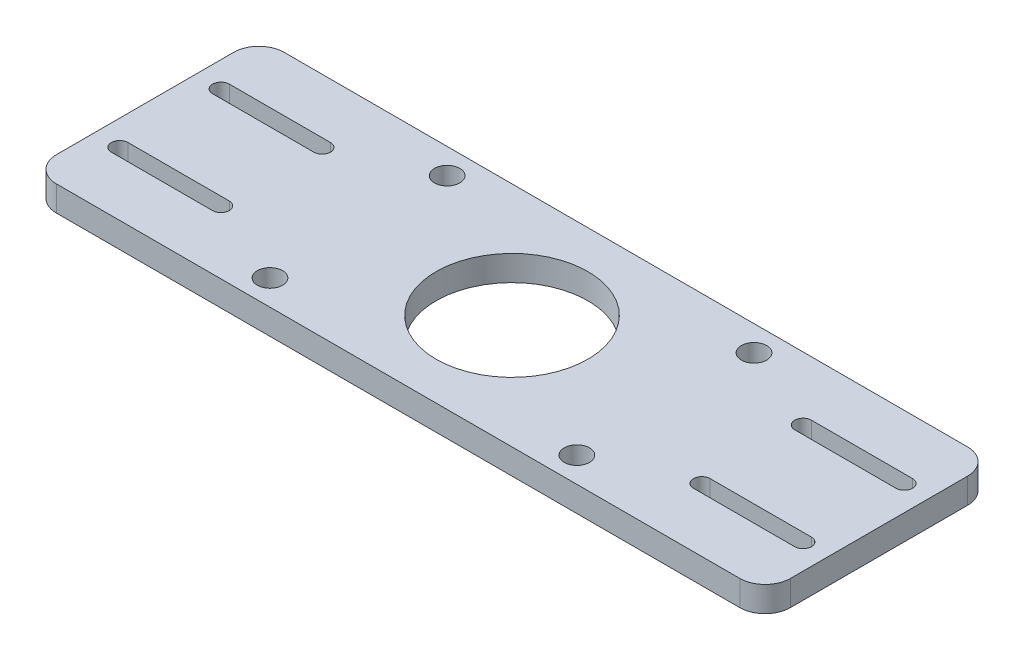
from build123d import *

# Parameters (mm, degrees)
SKETCH1_W           = 145
SKETCH1_H           = 45
BOSS_EXTRUDE1_DEPTH = 5
CUT_EXTRUDE1_DEPTH  = 77.075620274
FILLET1_R           = 5
FILLET2_R           = 5
FILLET3_R           = 5
FILLET4_R           = 5
SKETCH3_R           = 2.5
CUT_EXTRUDE2_DEPTH  = 77.075620274
SKETCH4_R           = 15
CUT_EXTRUDE3_DEPTH  = 77.075620274


with BuildPart() as part:
    # Sketch1 → Boss-Extrude1 (new body)
    with BuildSketch(Plane(origin=(0, 0, 0), x_dir=(1, 0, 0), z_dir=(0, 1, 0))):
        Rectangle(SKETCH1_W, SKETCH1_H)
    extrude(amount=BOSS_EXTRUDE1_DEPTH)

    # Sketch2 → Cut-Extrude1 (cut, through all)
    with BuildSketch(Plane(origin=(0, 5, 0), x_dir=(1, 0, 0), z_dir=(0, 1, 0))):
        with BuildLine():
            Line((-67.5, 8.35), (-47.5, 8.35))
            ThreePointArc((-47.5, 8.35), (-45.85, 10), (-47.5, 11.65))
            Line((-47.5, 11.65), (-67.5, 11.65))
            ThreePointArc((-67.5, 11.65), (-69.15, 10), (-67.5, 8.35))
        make_face()
        with BuildLine():
            Line((-47.5, -11.65), (-67.5, -11.65))
            ThreePointArc((-67.5, -11.65), (-69.15, -10), (-67.5, -8.35))
            Line((-67.5, -8.35), (-47.5, -8.35))
            ThreePointArc((-47.5, -8.35), (-45.85, -10), (-47.5, -11.65))
        make_face()
        with BuildLine():
            Line((47.5, 11.65), (67.5, 11.65))
            ThreePointArc((67.5, 11.65), (69.15, 10), (67.5, 8.35))
            Line((67.5, 8.35), (47.5, 8.35))
            ThreePointArc((47.5, 8.35), (45.85, 10), (47.5, 11.65))
        make_face()
        with BuildLine():
            Line((47.5, -11.65), (67.5, -11.65))
            ThreePointArc((67.5, -11.65), (69.15, -10), (67.5, -8.35))
            Line((67.5, -8.35), (47.5, -8.35))
            ThreePointArc((47.5, -8.35), (45.85, -10), (47.5, -11.65))
        make_face()
    extrude(amount=-CUT_EXTRUDE1_DEPTH, mode=Mode.SUBTRACT)

    # Fillet1
    fillet1_edges = [part.edges().sort_by_distance(p)[0] for p in [
        (72.5, 2.5, -22.5),
    ]]
    fillet(fillet1_edges, radius=FILLET1_R)

    # Fillet2
    fillet2_edges = [part.edges().sort_by_distance(p)[0] for p in [
        (-72.5, 2.5, -22.5),
    ]]
    fillet(fillet2_edges, radius=FILLET2_R)

    # Fillet3
    fillet3_edges = [part.edges().sort_by_distance(p)[0] for p in [
        (-72.5, 2.5, 22.5),
    ]]
    fillet(fillet3_edges, radius=FILLET3_R)

    # Fillet4
    fillet4_edges = [part.edges().sort_by_distance(p)[0] for p in [
        (72.5, 2.5, 22.5),
    ]]
    fillet(fillet4_edges, radius=FILLET4_R)

    # Sketch3 → Cut-Extrude2 (cut, through all)
    with BuildSketch(Plane(origin=(0, 5, 0), x_dir=(1, 0, 0), z_dir=(0, 1, 0))):
        with Locations(Location((30.310889132, 17.5, 0), (0, 0, 270))):
            Circle(SKETCH3_R)
        with Locations(Location((30.310889132, -17.5, 0), (0, 0, 270))):
            Circle(SKETCH3_R)
        with Locations(Location((-30.310889132, -17.5, 0), (0, 0, 270))):
            Circle(SKETCH3_R)
        with Locations(Location((-30.310889132, 17.5, 0), (0, 0, 270))):
            Circle(SKETCH3_R)
    extrude(amount=-CUT_EXTRUDE2_DEPTH, mode=Mode.SUBTRACT)

    # Sketch4 → Cut-Extrude3 (cut, through all)
    with BuildSketch(Plane(origin=(0, 5, 0), x_dir=(1, 0, 0), z_dir=(0, 1, 0))):
        with Locations(Location((0, 0, 0), (0, 0, 270))):
            Circle(SKETCH4_R)
    extrude(amount=-CUT_EXTRUDE3_DEPTH, mode=Mode.SUBTRACT)


solid = part.part
